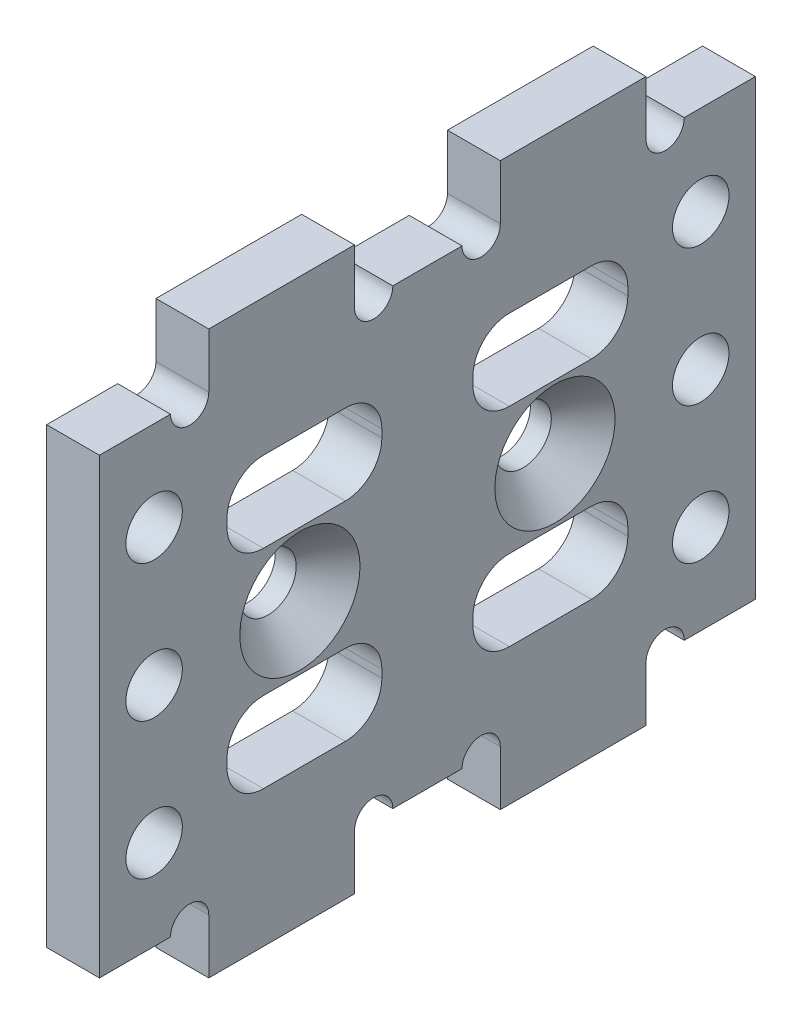
from build123d import *

# Parameters (mm, degrees)
EXTRUDE_1_DEPTH          = 2.9
SKETCH_2_R               = 1.55
SKETCH_2_W               = 8.5
SKETCH_2_H               = 4.425
CUT_EXTRUDE_1_DEPTH      = 10
FILLET_1_R               = 2
HOLE_WIZARD_1_AT_2_COUNT = 2
HOLE_WIZARD_1_AT_2_PITCH = 14


with BuildPart() as part:
    # 草图1 → 凸台-拉伸1 (new body)
    with BuildSketch(Plane(origin=(0, 0, 0), x_dir=(0, 0, -1), z_dir=(1, 0, 0))):
        with BuildLine():
            Line((-12, 15.425), (-12, 12.425))
            ThreePointArc((-12, 12.425), (-13.05, 11.375), (-14.1, 12.425))
            Line((-14.1, 12.425), (-18, 12.425))
            Line((-18, 12.425), (-18, -12.425))
            Line((-18, -12.425), (-14.1, -12.425))
            ThreePointArc((-14.1, -12.425), (-13.05, -11.375), (-12, -12.425))
            Line((-12, -12.425), (-12, -15.425))
            Line((-12, -15.425), (-4, -15.425))
            Line((-4, -15.425), (-4, -12.425))
            ThreePointArc((-4, -12.425), (-2.95, -11.375), (-1.9, -12.425))
            Line((-1.9, -12.425), (1.9, -12.425))
            ThreePointArc((1.9, -12.425), (2.95, -11.375), (4, -12.425))
            Line((4, -12.425), (4, -15.425))
            Line((4, -15.425), (12, -15.425))
            Line((12, -15.425), (12, -12.425))
            ThreePointArc((12, -12.425), (13.05, -11.375), (14.1, -12.425))
            Line((14.1, -12.425), (18, -12.425))
            Line((18, -12.425), (18, 12.425))
            Line((18, 12.425), (14.1, 12.425))
            ThreePointArc((14.1, 12.425), (13.05, 11.375), (12, 12.425))
            Line((12, 12.425), (12, 15.425))
            Line((12, 15.425), (4, 15.425))
            Line((4, 15.425), (4, 12.425))
            ThreePointArc((4, 12.425), (2.95, 11.375), (1.9, 12.425))
            Line((1.9, 12.425), (-1.9, 12.425))
            ThreePointArc((-1.9, 12.425), (-2.95, 11.375), (-4, 12.425))
            Line((-4, 12.425), (-4, 15.425))
            Line((-4, 15.425), (-12, 15.425))
        make_face()
    extrude(amount=EXTRUDE_1_DEPTH)

    # 草图2 → 切除-拉伸1 (cut)
    with BuildSketch(Plane.ZY):
        with Locations((-15, 7.5)):
            Circle(SKETCH_2_R)
        with Locations(Location((-15, -7.5, 0), (0, 0, 180))):
            Circle(SKETCH_2_R)
        with Locations((15, 0)):
            Circle(SKETCH_2_R)
        with Locations((-15, 0)):
            Circle(SKETCH_2_R)
        with Locations((15, -7.5)):
            Circle(SKETCH_2_R)
        with Locations(Location((15, 7.5, 0), (0, 0, 180))):
            Circle(SKETCH_2_R)
        with Locations((-7, 0)):
            Circle(SKETCH_2_R)
        with Locations((7, 0)):
            Circle(SKETCH_2_R)
        with Locations((-6.75, 5.7125)):
            Rectangle(SKETCH_2_W, SKETCH_2_H)
        with Locations((-6.75, -5.7125)):
            Rectangle(SKETCH_2_W, SKETCH_2_H)
        with Locations((6.75, -5.7125)):
            Rectangle(SKETCH_2_W, SKETCH_2_H)
        with Locations((6.75, 5.7125)):
            Rectangle(SKETCH_2_W, SKETCH_2_H)
    extrude(amount=-CUT_EXTRUDE_1_DEPTH, mode=Mode.SUBTRACT)

    # 圆角1
    fillet_1_edges = [part.edges().sort_by_distance(p)[0] for p in [
        (1.45, -3.5, -2.5),
        (1.45, -7.925, -2.5),
        (1.45, -7.925, -11),
        (1.45, -3.5, -11),
        (1.45, 3.5, -11),
        (1.45, 7.925, -11),
        (1.45, 7.925, -2.5),
        (1.45, 3.5, -2.5),
        (1.45, 7.925, 11),
        (1.45, 3.5, 11),
        (1.45, 3.5, 2.5),
        (1.45, 7.925, 2.5),
        (1.45, -7.925, 11),
        (1.45, -7.925, 2.5),
        (1.45, -3.5, 2.5),
        (1.45, -3.5, 11),
    ]]
    fillet(fillet_1_edges, radius=FILLET_1_R)

    # 草图3 → 打孔尺寸(%根据十字)槽沉头木螺钉的类型1 (revolve, cut)
    with BuildSketch(Plane(origin=(2.9, 0, 7), x_dir=(0, 0, -1), z_dir=(0, 1, 0))):
        Polygon((0, 0), (0, 2.9), (1.55, 2.9), (1.55, 1.75), (3.3, 0), align=None)
    hole_wizard_1 = revolve(axis=Axis((9.25, 0, 7), (-1, 0, 0)), mode=Mode.SUBTRACT)

    # 打孔尺寸(%根据十字)槽沉头木螺钉的类型1 at 2: 打孔尺寸(%根据十字)槽沉头木螺钉的类型1 ×2
    with Locations(*[(0, 0, -i * HOLE_WIZARD_1_AT_2_PITCH) for i in range(1, HOLE_WIZARD_1_AT_2_COUNT)]):
        add(hole_wizard_1, mode=Mode.SUBTRACT)


solid = part.part
